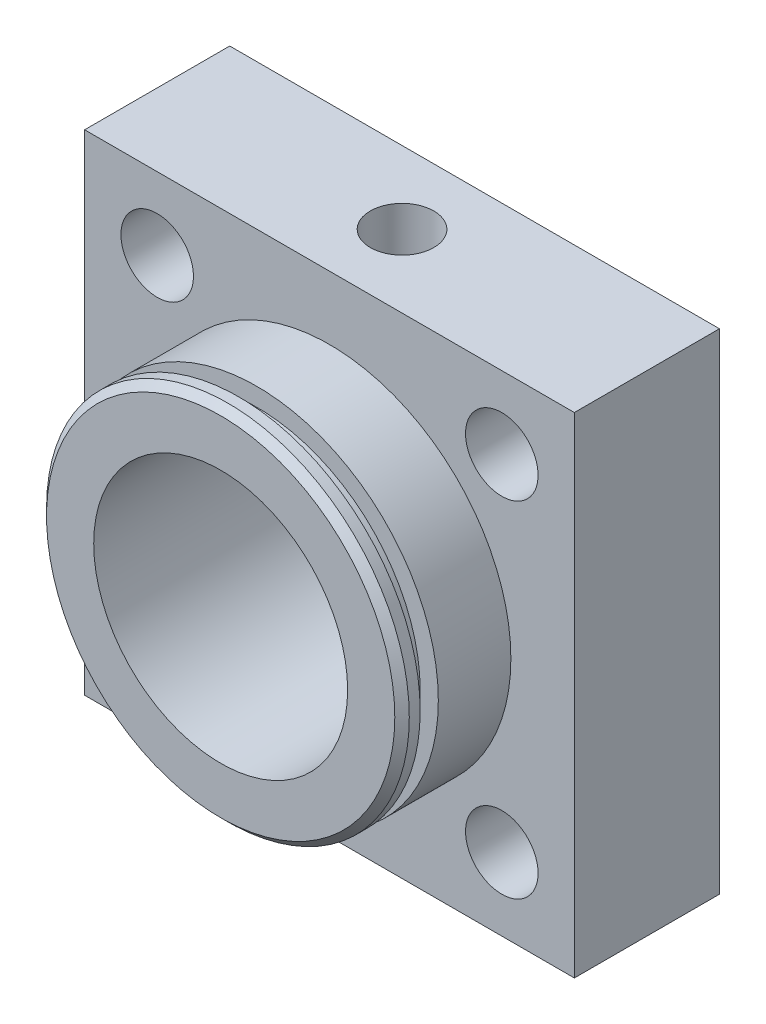
from build123d import *

# Parameters (mm, degrees)
SKETCH1_W              = 135
SKETCH1_H              = 135
BOSS_EXTRUDE1_DEPTH    = 40
SKETCH2_R              = 10
CUT_EXTRUDE1_DEPTH     = 104.501207722
SKETCH4_R              = 50
BOSS_EXTRUDE2_DEPTH    = 20
SKETCH5_R              = 45
BOSS_EXTRUDE3_DEPTH    = 5
SKETCH6_R              = 50
BOSS_EXTRUDE4_DEPTH    = 5
CHAMFER1_SIZE          = 2
SKETCH7_R              = 35
CUT_EXTRUDE2_DEPTH     = 65
M20X2_5_TAPPED_HOLE1_D = 17.5


with BuildPart() as part:
    # Sketch1 → Boss-Extrude1 (new body)
    with BuildSketch(Plane.XY):
        Rectangle(SKETCH1_W, SKETCH1_H)
    extrude(amount=BOSS_EXTRUDE1_DEPTH)

    # Sketch2 → Cut-Extrude1 (cut, through all)
    with BuildSketch(Plane.XY.offset(40)):
        with Locations((-47.5, 47.5)):
            Circle(SKETCH2_R)
        with Locations(Location((47.5, 47.5, 0), (0, 0, 180))):
            Circle(SKETCH2_R)
        with Locations((47.5, -47.5)):
            Circle(SKETCH2_R)
        with Locations(Location((-47.5, -47.5, 0), (0, 0, 180))):
            Circle(SKETCH2_R)
    extrude(amount=-CUT_EXTRUDE1_DEPTH, mode=Mode.SUBTRACT)

    # Sketch4 → Boss-Extrude2 (add)
    with BuildSketch(Plane.XY.offset(40)):
        Circle(SKETCH4_R)
    extrude(amount=BOSS_EXTRUDE2_DEPTH)

    # Sketch5 → Boss-Extrude3 (add)
    with BuildSketch(Plane.XY.offset(60)):
        Circle(SKETCH5_R)
    extrude(amount=BOSS_EXTRUDE3_DEPTH)

    # Sketch6 → Boss-Extrude4 (add)
    with BuildSketch(Plane.XY.offset(65)):
        Circle(SKETCH6_R)
    extrude(amount=BOSS_EXTRUDE4_DEPTH)

    # Chamfer1
    chamfer1_edges = [part.edges().sort_by_distance(p)[0] for p in [
        (-50, 0, 70),
    ]]
    chamfer(chamfer1_edges, length=CHAMFER1_SIZE)

    # Sketch7 → Cut-Extrude2 (cut)
    with BuildSketch(Plane.XY.offset(70)):
        Circle(SKETCH7_R)
    extrude(amount=-CUT_EXTRUDE2_DEPTH, mode=Mode.SUBTRACT)

    # M20x2.5 Tapped Hole1 (through all)
    with Locations(Plane(origin=(0, -67.5, 20), x_dir=(-1, 0, 0), z_dir=(0, -1, 0))):
        with Locations((0, 0)):
            Hole(M20X2_5_TAPPED_HOLE1_D / 2)


solid = part.part
